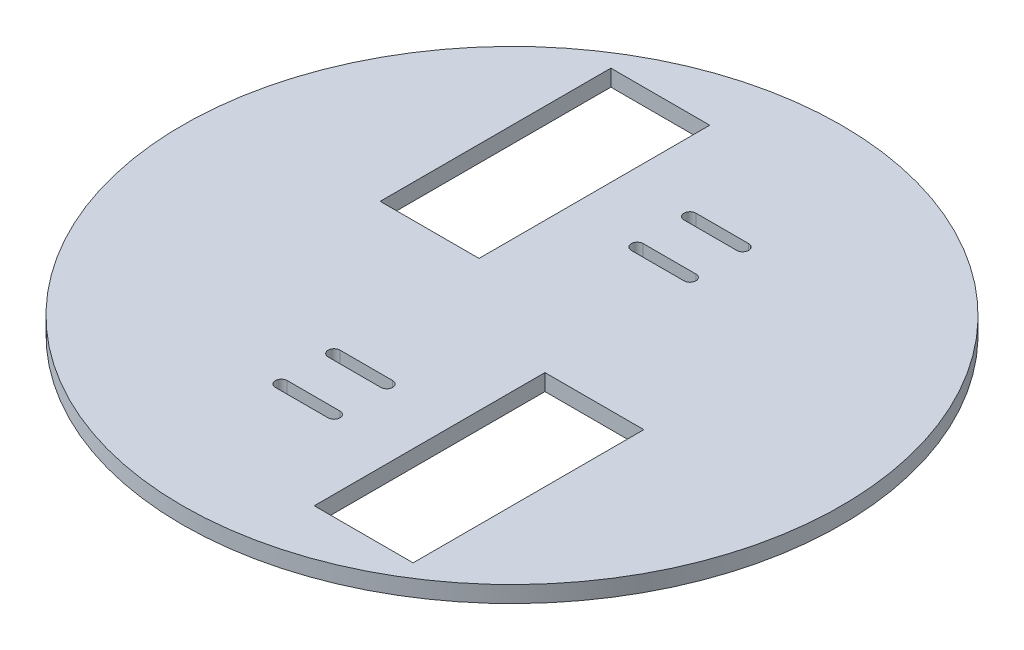
from build123d import *

# Parameters (mm, degrees)
SKETCH_1_R               = 100
EXTRUDE_1_DEPTH          = 5
SKETCH_3_W               = 30
SKETCH_3_H               = 70
CUT_EXTRUDE_1_DEPTH      = 142.509716981
CUT_EXTRUDE_2_DEPTH      = 142.509716981
PATTERN_CIRCULAR_1_COUNT = 2


with BuildPart() as part:
    # 草图1 → 凸台-拉伸1 (new body)
    with BuildSketch(Plane(origin=(0, 0, 0), x_dir=(1, 0, 0), z_dir=(0, 1, 0))):
        with Locations(Location((0, 0, 0), (0, 0, 270))):
            Circle(SKETCH_1_R)
    extrude(amount=EXTRUDE_1_DEPTH)

    # 草图3 → 切除-拉伸1 (cut, through all)
    with BuildSketch(Plane(origin=(0, 0, 0), x_dir=(1, 0, 0), z_dir=(0, 1, 0))):
        with Locations((35, -45)):
            Rectangle(SKETCH_3_W, SKETCH_3_H)
    cut_extrude_1 = extrude(amount=CUT_EXTRUDE_1_DEPTH, mode=Mode.SUBTRACT)

    # 草图2 → 切除-拉伸2 (cut, through all)
    with BuildSketch(Plane(origin=(0, 0, 0), x_dir=(1, 0, 0), z_dir=(0, 1, 0))):
        with BuildLine():
            Line((-17, -35.2), (-1, -35.2))
            ThreePointArc((-1, -35.2), (0.8, -37), (-1, -38.8))
            Line((-1, -38.8), (-17, -38.8))
            ThreePointArc((-17, -38.8), (-18.8, -37), (-17, -35.2))
        make_face()
        with BuildLine():
            Line((-17, -54.8), (-1, -54.8))
            ThreePointArc((-1, -54.8), (0.8, -53), (-1, -51.2))
            Line((-1, -51.2), (-17, -51.2))
            ThreePointArc((-17, -51.2), (-18.8, -53), (-17, -54.8))
        make_face()
    cut_extrude_2 = extrude(amount=CUT_EXTRUDE_2_DEPTH, mode=Mode.SUBTRACT)

    # 阵列(圆周)1: 切除-拉伸1, 切除-拉伸2 ×2 about axis
    pattern_circular_1_axis = Axis((0, 0, 0), (0, 1, 0))
    add([cut_extrude_1.rotate(pattern_circular_1_axis, i * 360 / PATTERN_CIRCULAR_1_COUNT) for i in range(1, PATTERN_CIRCULAR_1_COUNT)], mode=Mode.SUBTRACT)
    add([cut_extrude_2.rotate(pattern_circular_1_axis, i * 360 / PATTERN_CIRCULAR_1_COUNT) for i in range(1, PATTERN_CIRCULAR_1_COUNT)], mode=Mode.SUBTRACT)


solid = part.part
